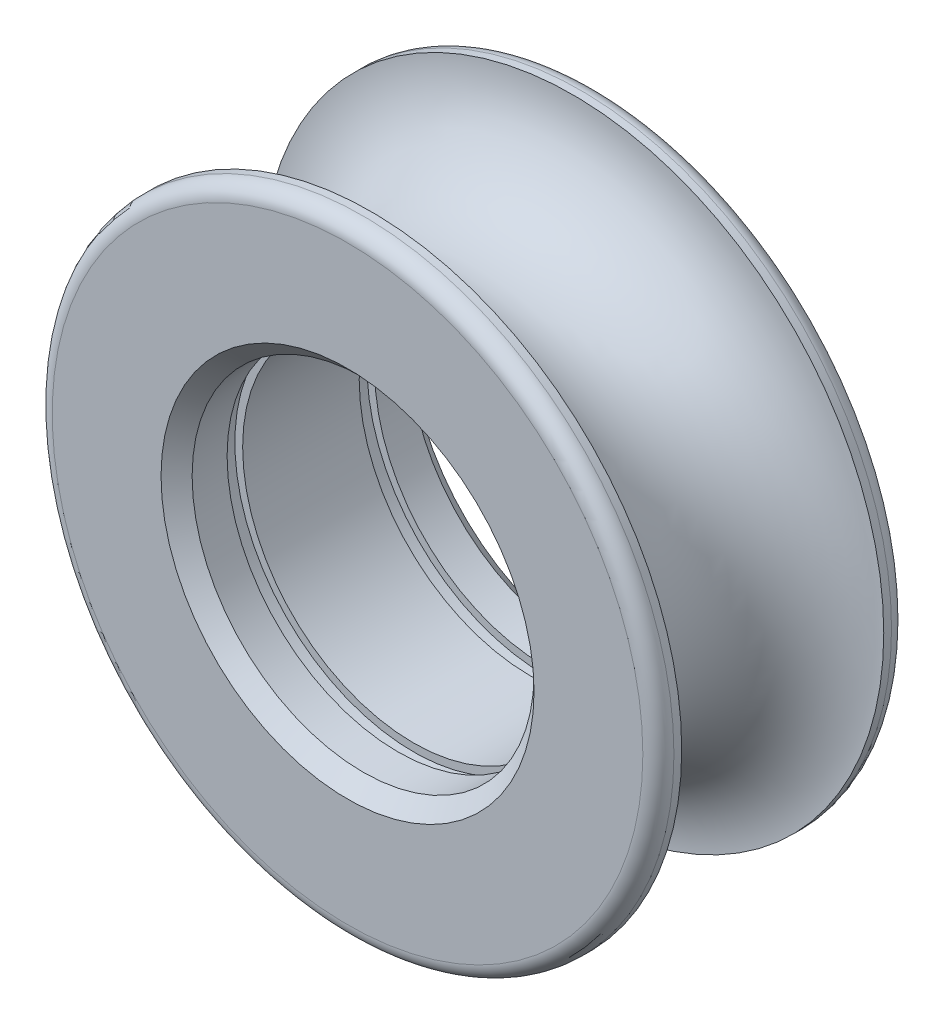
from build123d import *

# Parameters (mm, degrees)
CUT_EXTRUDE1_START = -4.25
SKETCH2_R          = 11.5
SKETCH2_R_2        = 11
CUT_EXTRUDE1_DEPTH = 1
CUT_EXTRUDE2_START = -12.75
SKETCH2_2_R        = 11.5
SKETCH2_2_R_2      = 11
CUT_EXTRUDE2_DEPTH = 1
SCALE1_SCALE       = 1.013


with BuildPart() as part:
    # Sketch1 → Revolve1 (revolve)
    with BuildSketch(Plane(origin=(0, 0, 0), x_dir=(0, 0, -1), z_dir=(1, 0, 0))):
        with BuildLine():
            Line((-7, 11), (7, 11))
            Line((7, 11), (8, 12))
            Line((8, 12), (8, 19))
            ThreePointArc((8, 19), (7.707106781, 19.707106781), (7, 20))
            Line((7, 20), (6.5, 20))
            ThreePointArc((6.5, 20), (0, 13.5), (-6.5, 20))
            Line((-6.5, 20), (-7, 20))
            ThreePointArc((-7, 20), (-7.707106781, 19.707106781), (-8, 19))
            Line((-8, 19), (-8, 12))
            Line((-8, 12), (-7, 11))
        make_face()
    revolve(axis=Axis((0, 0, 0), (0, 0, -1)))

    # Sketch2 → Cut-Extrude1 (cut)
    with BuildSketch(Plane.XY.offset(8).offset(CUT_EXTRUDE1_START)):
        Circle(SKETCH2_R)
        Circle(SKETCH2_R_2, mode=Mode.SUBTRACT)
    extrude(amount=CUT_EXTRUDE1_DEPTH, mode=Mode.SUBTRACT)

    # Sketch2<2> → Cut-Extrude2 (cut)
    with BuildSketch(Plane.XY.offset(8).offset(CUT_EXTRUDE2_START)):
        Circle(SKETCH2_2_R)
        Circle(SKETCH2_2_R_2, mode=Mode.SUBTRACT)
    extrude(amount=CUT_EXTRUDE2_DEPTH, mode=Mode.SUBTRACT)


with BuildPart() as part_1:
    # Scale1: scaled about (0, 0, 0)
    add(part.part.scale(SCALE1_SCALE))


solid = part_1.part
